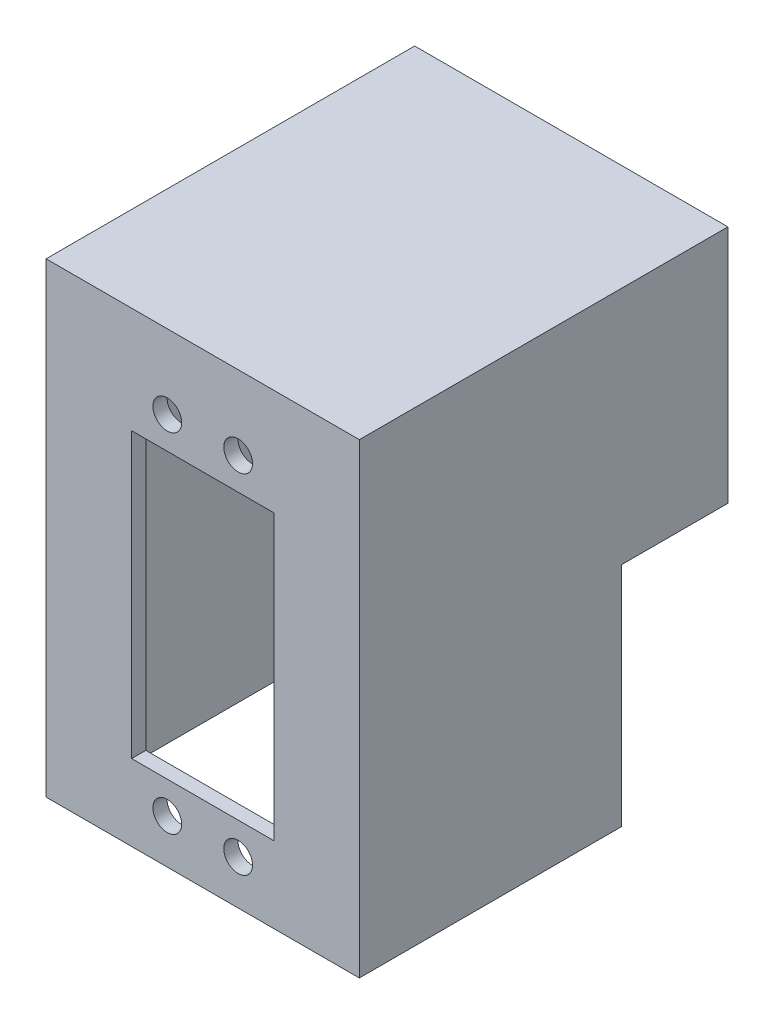
from build123d import *

# Parameters (mm, degrees)
SKETCH1_W                       = 184
SKETCH1_H                       = 64
SKETCH1_W_2                     = 180
SKETCH1_H_2                     = 60
EXTRUDE_THIN1_DEPTH             = 30
SKETCH3_W                       = 184
SKETCH3_H                       = 64
BOSS_EXTRUDE1_DEPTH             = 2
SKETCH4_W                       = 174.419493498
SKETCH4_H                       = 4
CUT_EXTRUDE1_DEPTH              = 5
SKETCH5_W                       = 40.195784268
SKETCH5_H                       = 59.069599678
CUT_EXTRUDE2_DEPTH              = 15
SKETCH6_W                       = 44.195784268
SKETCH6_H                       = 67.776893145
SKETCH6_W_2                     = 40.195784268
SKETCH6_H_2                     = 63.776893145
EXTRUDE_THIN2_DEPTH             = 35
EXTRUDE_THIN2_DIRECTION_2_REACH = 118.55
SKETCH7_W                       = 128.018506196
SKETCH7_H                       = 58.604777903
CUT_EXTRUDE3_DEPTH              = 85
SKETCH8_W                       = 13
SKETCH8_H                       = 30
CUT_EXTRUDE4_DEPTH              = 85
SKETCH9_W                       = 44.195784268
SKETCH9_H                       = 65.776893145
BOSS_EXTRUDE2_DEPTH             = 2
SKETCH13_W                      = 20.06
SKETCH13_H                      = 40.06
CUT_EXTRUDE6_DEPTH              = 10
SKETCH18_R                      = 2.03
CUT_EXTRUDE8_DEPTH              = 10
SKETCH19_W                      = 50
SKETCH19_H                      = 40
CUT_EXTRUDE9_DEPTH              = 10
SKETCH20_R                      = 2.03
CUT_EXTRUDE10_DEPTH             = 10
SKETCH21_W                      = 64
SKETCH21_H                      = 32
CUT_EXTRUDE11_DEPTH             = 217


with BuildPart() as part:
    # Sketch1 → Extrude-Thin1 (new body)
    with BuildSketch(Plane(origin=(0, 0, 0), x_dir=(1, 0, 0), z_dir=(0, 1, 0))):
        Rectangle(SKETCH1_W, SKETCH1_H)
        Rectangle(SKETCH1_W_2, SKETCH1_H_2, mode=Mode.SUBTRACT)
    extrude(amount=EXTRUDE_THIN1_DEPTH)

    # Sketch3 → Boss-Extrude1 (add)
    with BuildSketch(Plane(origin=(0, 30, 0), x_dir=(1, 0, 0), z_dir=(0, 1, 0))):
        Rectangle(SKETCH3_W, SKETCH3_H)
    extrude(amount=BOSS_EXTRUDE1_DEPTH)

    # Sketch4 → Cut-Extrude1 (cut)
    with BuildSketch(Plane(origin=(0, 32, 0), x_dir=(1, 0, 0), z_dir=(0, 1, 0))):
        with Locations((0, -2)):
            Rectangle(SKETCH4_W, SKETCH4_H)
    extrude(amount=-CUT_EXTRUDE1_DEPTH, mode=Mode.SUBTRACT)

    # Sketch5 → Cut-Extrude2 (cut)
    with BuildSketch(Plane.XY.offset(32)):
        with Locations((0, 16)):
            Rectangle(SKETCH5_W, SKETCH5_H)
    extrude(amount=-CUT_EXTRUDE2_DEPTH, mode=Mode.SUBTRACT)

    # Sketch6 → Extrude-Thin2 (add)
    with BuildSketch(Plane.XY.offset(32)):
        with Locations((0, 31.888446573)):
            Rectangle(SKETCH6_W, SKETCH6_H)
        with Locations((0, 31.888446573)):
            Rectangle(SKETCH6_W_2, SKETCH6_H_2, mode=Mode.SUBTRACT)
    extrude(amount=EXTRUDE_THIN2_DEPTH)

    # Extrude-Thin2 direction 2: up to this face of the body (flat: up to its plane)
    extrude_thin2_direction_2_end = Plane(part.part.faces().sort_by_distance((0, 31, 17))[0])
    # Sketch6 → Extrude-Thin2 direction 2 (add, up to the picked face)
    with BuildSketch(Plane.XY.offset(32), mode=Mode.PRIVATE) as extrude_thin2_direction_2_sk1:
        with Locations((0, 31.888446573)):
            Rectangle(SKETCH6_W, SKETCH6_H)
        with Locations((0, 31.888446573)):
            Rectangle(SKETCH6_W_2, SKETCH6_H_2, mode=Mode.SUBTRACT)
    extrude_thin2_direction_2_tool1 = split(extrude(extrude_thin2_direction_2_sk1.sketch, amount=-EXTRUDE_THIN2_DIRECTION_2_REACH, mode=Mode.PRIVATE), bisect_by=extrude_thin2_direction_2_end, keep=Keep.BOTH, mode=Mode.PRIVATE)
    add(extrude_thin2_direction_2_tool1.solids().sort_by(Axis((0, -1.190866, 32), (0, 0, -1)))[0])

    # Sketch7 → Cut-Extrude3 (cut)
    with BuildSketch(Plane.XZ):
        with Locations((2.364457898, 44.353486129)):
            Rectangle(SKETCH7_W, SKETCH7_H)
    extrude(amount=CUT_EXTRUDE3_DEPTH, mode=Mode.SUBTRACT)

    # Sketch8 → Cut-Extrude4 (cut)
    with BuildSketch(Plane.ZY.offset(22.097892134)):
        with Locations((23.5, 15)):
            Rectangle(SKETCH8_W, SKETCH8_H)
    extrude(amount=-CUT_EXTRUDE4_DEPTH, mode=Mode.SUBTRACT)

    # Sketch9 → Boss-Extrude2 (add)
    with BuildSketch(Plane.XY.offset(67)):
        with Locations((0, 32.888446573)):
            Rectangle(SKETCH9_W, SKETCH9_H)
    extrude(amount=BOSS_EXTRUDE2_DEPTH)

    # Sketch13 → Cut-Extrude6 (cut)
    with BuildSketch(Plane.XY.offset(69)):
        with Locations((0, 30.776893145)):
            Rectangle(SKETCH13_W, SKETCH13_H)
    extrude(amount=-CUT_EXTRUDE6_DEPTH, mode=Mode.SUBTRACT)

    # Sketch18 → Cut-Extrude8 (cut)
    with BuildSketch(Plane.XY.offset(69)):
        with Locations((-5, 6.246893145)):
            Circle(SKETCH18_R)
        with Locations((5, 6.246893145)):
            Circle(SKETCH18_R)
    extrude(amount=-CUT_EXTRUDE8_DEPTH, mode=Mode.SUBTRACT)

    # Sketch19 → Cut-Extrude9 (cut)
    with BuildSketch(Plane.XY.offset(32)):
        with Locations((57.048946067, 0)):
            Rectangle(SKETCH19_W, SKETCH19_H)
    extrude(amount=-CUT_EXTRUDE9_DEPTH, mode=Mode.SUBTRACT)

    # Sketch20 → Cut-Extrude10 (cut)
    with BuildSketch(Plane.XY.offset(69)):
        with Locations((-5, 55.306893145)):
            Circle(SKETCH20_R)
        with Locations((5, 55.306893145)):
            Circle(SKETCH20_R)
    extrude(amount=-CUT_EXTRUDE10_DEPTH, mode=Mode.SUBTRACT)

    # Sketch21 → Cut-Extrude11 (cut)
    with BuildSketch(Plane.ZY.offset(92)):
        with Locations((0, 16)):
            Rectangle(SKETCH21_W, SKETCH21_H)
    extrude(amount=-CUT_EXTRUDE11_DEPTH, mode=Mode.SUBTRACT)


solid = part.part
